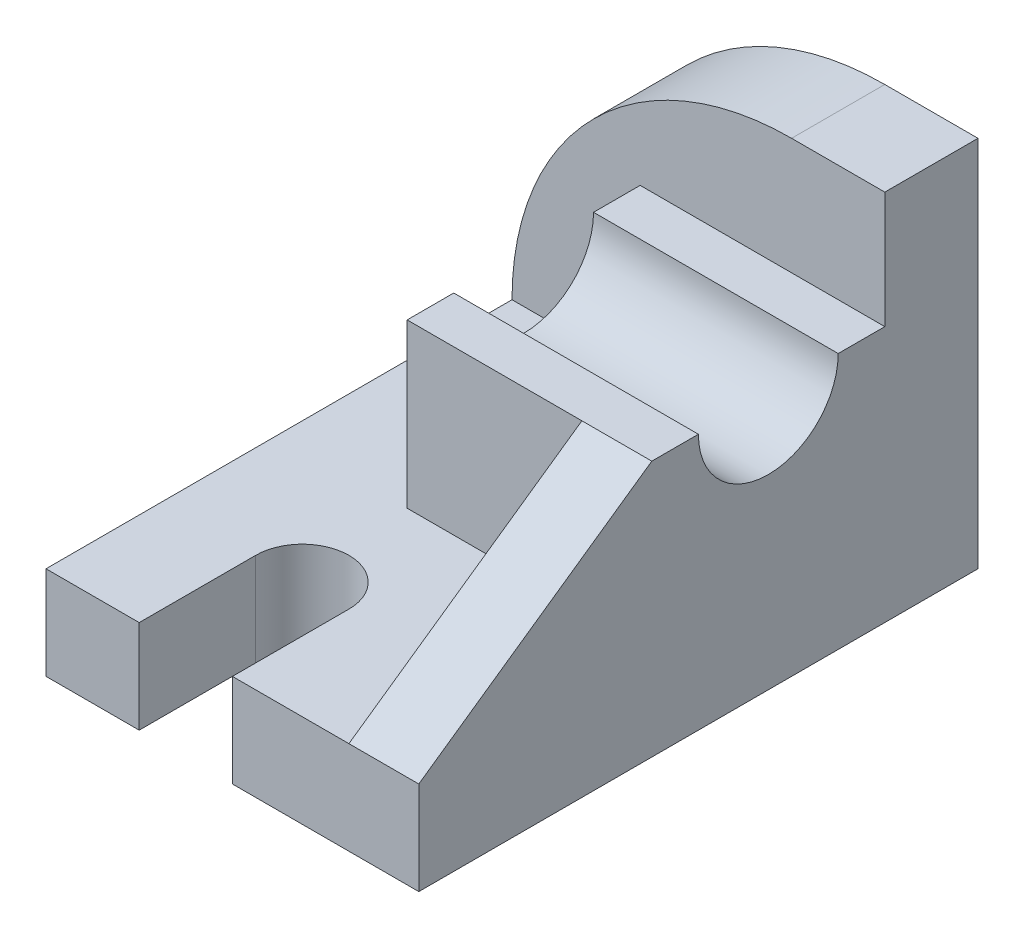
from build123d import *

# Parameters (mm, degrees)
SKETCH1_W           = 64
SKETCH1_H           = 96
BOSS_EXTRUDE1_DEPTH = 16
CUT_EXTRUDE1_DEPTH  = 16
BOSS_EXTRUDE2_DEPTH = 16
SKETCH15_W          = 40
SKETCH15_H          = 28
BOSS_EXTRUDE3_DEPTH = 42
SKETCH16_R          = 12
CUT_EXTRUDE2_DEPTH  = 123.784363825
BOSS_EXTRUDE4_DEPTH = 12


with BuildPart() as part:
    # Sketch1 → Boss-Extrude1 (new body)
    with BuildSketch(Plane(origin=(0, 0, 0), x_dir=(1, 0, 0), z_dir=(0, 1, 0))):
        with Locations((32, 48)):
            Rectangle(SKETCH1_W, SKETCH1_H)
    extrude(amount=BOSS_EXTRUDE1_DEPTH)

    # Sketch12 → Cut-Extrude1 (cut)
    with BuildSketch(Plane(origin=(0, 0, 0), x_dir=(1, 0, 0), z_dir=(0, 1, 0))):
        with BuildLine():
            Line((16, 0), (16, 20))
            ThreePointArc((16, 20), (24, 28), (32, 20))
            Line((32, 20), (32, 0))
            ThreePointArc((32, 0), (24, -8), (16, 0))
        make_face()
    extrude(amount=CUT_EXTRUDE1_DEPTH, mode=Mode.SUBTRACT)

    # Sketch14 → Boss-Extrude2 (add)
    with BuildSketch(Plane(origin=(0, 0, -96), x_dir=(-1, 0, 0), z_dir=(0, 0, -1))):
        with BuildLine():
            Line((0, 0), (-64, 0))
            Line((-64, 0), (-64, 64))
            Line((-64, 64), (-48, 64))
            ThreePointArc((-48, 64), (-14.058874503, 49.941125497), (0, 16))
            Line((0, 16), (0, 0))
        make_face()
    extrude(amount=-BOSS_EXTRUDE2_DEPTH)

    # Sketch15 → Boss-Extrude3 (add)
    with BuildSketch(Plane(origin=(64, 0, 0), x_dir=(0, 0, -1), z_dir=(1, 0, 0))):
        with Locations((60, 30)):
            Rectangle(SKETCH15_W, SKETCH15_H)
    extrude(amount=-BOSS_EXTRUDE3_DEPTH)

    # Sketch16 → Cut-Extrude2 (cut, through all)
    with BuildSketch(Plane.ZY.offset(-22)):
        with Locations((-60, 44)):
            Circle(SKETCH16_R)
    extrude(amount=-CUT_EXTRUDE2_DEPTH, mode=Mode.SUBTRACT)

    # Sketch17 → Boss-Extrude4 (add)
    with BuildSketch(Plane(origin=(64, 0, 0), x_dir=(0, 0, -1), z_dir=(1, 0, 0))):
        Polygon((0, 16), (40, 16), (40, 44), align=None)
    extrude(amount=-BOSS_EXTRUDE4_DEPTH)


solid = part.part
